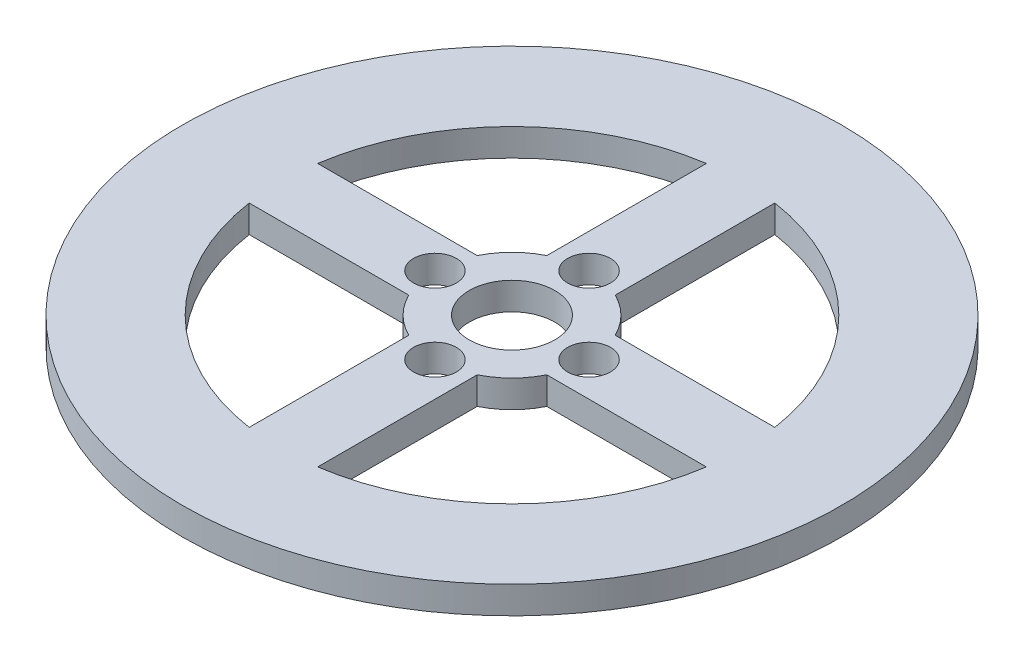
from build123d import *

# Parameters (mm, degrees)
CROQUIS1_R              = 19.25
SALIENTE_EXTRUIR1_DEPTH = 1.6
CROQUIS2_R              = 2.5
CROQUIS2_R_2            = 1.25
CORTAR_EXTRUIR1_DEPTH   = 1.6
CORTAR_EXTRUIR2_DEPTH   = 1.6


with BuildPart() as part:
    # Croquis1 → Saliente-Extruir1 (new body)
    with BuildSketch(Plane(origin=(0, 0, 0), x_dir=(1, 0, 0), z_dir=(0, 1, 0))):
        with Locations(Location((0, 0, 0), (0, 0, 270))):
            Circle(CROQUIS1_R)
    extrude(amount=SALIENTE_EXTRUIR1_DEPTH)

    # Croquis2 → Cortar-Extruir1 (cut)
    with BuildSketch(Plane(origin=(0, 1.6, 0), x_dir=(1, 0, 0), z_dir=(0, 1, 0))):
        with Locations(Location((0, 0, 0), (0, 0, 270))):
            Circle(CROQUIS2_R)
        with Locations(Location((0, 4.5, 0), (0, 0, 270))):
            Circle(CROQUIS2_R_2)
        with Locations(Location((4.5, 0, 0), (0, 0, 270))):
            Circle(CROQUIS2_R_2)
        with Locations(Location((0, -4.5, 0), (0, 0, 270))):
            Circle(CROQUIS2_R_2)
        with Locations(Location((-4.5, 0, 0), (0, 0, 270))):
            Circle(CROQUIS2_R_2)
    extrude(amount=-CORTAR_EXTRUIR1_DEPTH, mode=Mode.SUBTRACT)

    # Croquis3 → Cortar-Extruir2 (cut)
    with BuildSketch(Plane(origin=(0, 1.6, 0), x_dir=(1, 0, 0), z_dir=(0, 1, 0))):
        with BuildLine():
            Line((-2, 4.031128874), (-2, 13.351029923))
            ThreePointArc((-2, 13.351029923), (-9.545941546, 9.545941546), (-13.351029923, 2))
            Line((-13.351029923, 2), (-4.031128874, 2))
            ThreePointArc((-4.031128874, 2), (-3.181980515, 3.181980515), (-2, 4.031128874))
        make_face()
        with BuildLine():
            ThreePointArc((13.351029923, 2), (9.545941546, 9.545941546), (2, 13.351029923))
            Line((2, 13.351029923), (2, 4.031128874))
            ThreePointArc((2, 4.031128874), (3.181980515, 3.181980515), (4.031128874, 2))
            Line((4.031128874, 2), (13.351029923, 2))
        make_face()
        with BuildLine():
            ThreePointArc((2, -13.351029923), (9.545941546, -9.545941546), (13.351029923, -2))
            Line((13.351029923, -2), (4.031128874, -2))
            ThreePointArc((4.031128874, -2), (3.181980515, -3.181980515), (2, -4.031128874))
            Line((2, -4.031128874), (2, -13.351029923))
        make_face()
        with BuildLine():
            Line((-4.031128874, -2), (-13.351029923, -2))
            ThreePointArc((-13.351029923, -2), (-9.545941546, -9.545941546), (-2, -13.351029923))
            Line((-2, -13.351029923), (-2, -4.031128874))
            ThreePointArc((-2, -4.031128874), (-3.181980515, -3.181980515), (-4.031128874, -2))
        make_face()
    extrude(amount=-CORTAR_EXTRUIR2_DEPTH, mode=Mode.SUBTRACT)


solid = part.part
